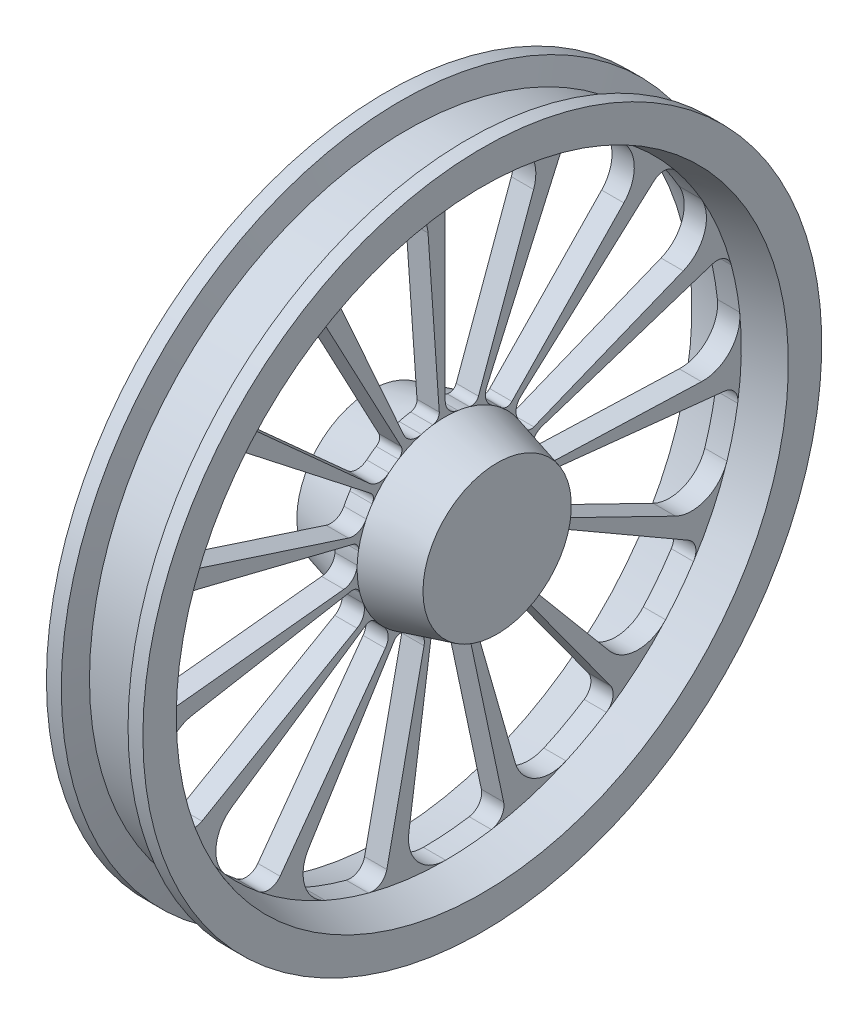
from build123d import *

# Parameters (mm, degrees)
CUT_EXTRUDE1_DEPTH = 655.685038778


with BuildPart() as part:
    # Sketch1 → Revolve1 (revolve)
    with BuildSketch(Plane(origin=(0, 0, 0), x_dir=(1, 0, 0), z_dir=(0, 1, 0)), mode=Mode.PRIVATE) as revolve1_sk:
        Polygon((85, 0), (85, 100), (15, 118.75644347), (15, 399.102540378), (65, 412.5), (65, 457.5), (45, 457.5), (36.961524227, 427.5), (-36.961524227, 427.5), (-45, 457.5), (-65, 457.5), (-65, 412.5), (-15, 399.102540378), (-15, 118.75644347), (-85, 100), (-85, 0), align=None)
    revolve(revolve1_sk.sketch.rotate(Axis((-85, 0, 0), (1, 0, 0)), 180), axis=Axis((-85, 0, 0), (1, 0, 0)))

    # Sketch2 → Cut-Extrude1 (cut, through all)
    with BuildSketch(Plane(origin=(15, 0, 0), x_dir=(0, 0, -1), z_dir=(1, 0, 0))):
        with BuildLine():
            Line((0, 378.574611036), (0, 137.307503817))
            ThreePointArc((0, 137.307503817), (4.872955011, 124.224212568), (17.11725099, 117.516350285))
            ThreePointArc((17.11725099, 117.516350285), (24.945394865, 116.106934077), (32.661634023, 114.176663678))
            ThreePointArc((32.661634023, 114.176663678), (39.954655603, 114.882387256), (44.808864389, 120.370817503))
            Line((44.808864389, 120.370817503), (119.095852039, 324.472638633))
            ThreePointArc((119.095852039, 324.472638633), (115.825470883, 365.844293858), (82.439306972, 390.495324431))
            ThreePointArc((82.439306972, 390.495324431), (51.903571038, 395.713099417), (21.055123502, 398.546759504))
            ThreePointArc((21.055123502, 398.546759504), (6.235961168, 393.084994733), (0, 378.574611036))
        make_face()
        with BuildLine():
            Line((153.980166447, 345.845116291), (55.847993172, 125.436646412))
            ThreePointArc((55.847993172, 125.436646412), (54.978205124, 111.502455758), (63.435592711, 100.394314795))
            ThreePointArc((63.435592711, 100.394314795), (70.013696772, 95.922756059), (76.277720303, 91.020889092))
            ThreePointArc((76.277720303, 91.020889092), (83.227270678, 88.699260545), (89.89415676, 91.738806481))
            Line((89.89415676, 91.738806481), (240.774386462, 247.97985809))
            ThreePointArc((240.774386462, 247.97985809), (254.614112777, 287.104929649), (234.140811811, 323.204142889))
            ThreePointArc((234.140811811, 323.204142889), (208.367289235, 340.390820254), (181.338383505, 355.52669155))
            ThreePointArc((181.338383505, 355.52669155), (165.5789052, 356.564617494), (153.980166447, 345.845116291))
        make_face()
        with BuildLine():
            Line((281.335763249, 253.315859035), (102.039360961, 91.876653287))
            ThreePointArc((102.039360961, 91.876653287), (95.57722411, 79.500911379), (98.785344157, 65.913190223))
            ThreePointArc((98.785344157, 65.913190223), (102.975994453, 59.152662088), (106.704695781, 52.126775883))
            ThreePointArc((106.704695781, 52.126775883), (112.109134558, 47.17922588), (119.435932765, 47.244322398))
            Line((119.435932765, 47.244322398), (320.820842099, 128.609107256))
            ThreePointArc((320.820842099, 128.609107256), (349.377661475, 158.722514837), (345.357243186, 200.028028825))
            ThreePointArc((345.357243186, 200.028028825), (328.802410166, 226.211875916), (310.266589592, 251.032828769))
            ThreePointArc((310.266589592, 251.032828769), (296.291752286, 258.390978603), (281.335763249, 253.315859035))
        make_face()
        with BuildLine():
            Line((360.04585073, 116.985988449), (130.587196242, 42.430352135))
            ThreePointArc((130.587196242, 42.430352135), (119.650072756, 33.75293718), (117.054212162, 20.035076259))
            ThreePointArc((117.054212162, 20.035076259), (118.132807185, 12.154535457), (118.681459977, 4.219469567))
            ThreePointArc((118.681459977, 4.219469567), (121.606310593, -2.498525551), (128.326150953, -5.419134229))
            Line((128.326150953, -5.419134229), (345.394459571, -12.999326599))
            ThreePointArc((345.394459571, -12.999326599), (383.730638507, 2.895535261), (396.858269742, 42.265251379))
            ThreePointArc((396.858269742, 42.265251379), (392.384607303, 72.918843162), (385.546883655, 103.133109332))
            ThreePointArc((385.546883655, 103.133109332), (375.773063676, 115.539192102), (360.04585073, 116.985988449))
        make_face()
        with BuildLine():
            Line((376.500739706, -39.571822324), (136.555318945, -14.352542369))
            ThreePointArc((136.555318945, -14.352542369), (123.034336835, -17.831226494), (115.08334348, -29.307284402))
            ThreePointArc((115.08334348, -29.307284402), (112.863384353, -36.945220775), (110.137121556, -44.41742137))
            ThreePointArc((110.137121556, -44.41742137), (110.076650767, -51.744259215), (115.027611835, -57.145573317))
            Line((115.027611835, -57.145573317), (310.246237173, -152.360058789))
            ThreePointArc((310.246237173, -152.360058789), (351.733102059, -153.432108666), (379.738896115, -122.805571999))
            ThreePointArc((379.738896115, -122.805571999), (388.119941135, -92.982520022), (394.162618951, -62.599261644))
            ThreePointArc((394.162618951, -62.599261644), (390.279798565, -47.290370353), (376.500739706, -39.571822324))
        make_face()
        with BuildLine():
            Line((327.855230385, -189.287305518), (118.911786436, -68.653751909))
            ThreePointArc((118.911786436, -68.653751909), (105.144846344, -66.332209115), (93.213519211, -73.582149343))
            ThreePointArc((93.213519211, -73.582149343), (88.078857034, -79.656812699), (82.549074253, -85.374136632))
            ThreePointArc((82.549074253, -85.374136632), (79.51373801, -92.042940379), (81.839753638, -98.991023627))
            Line((81.839753638, -98.991023627), (221.453621869, -265.376352668))
            ThreePointArc((221.453621869, -265.376352668), (258.917716869, -283.229947119), (296.95921753, -266.642196324))
            ThreePointArc((296.95921753, -266.642196324), (316.745811186, -242.806360774), (334.624056575, -217.507651584))
            ThreePointArc((334.624056575, -217.507651584), (337.303610701, -201.942998155), (327.855230385, -189.287305518))
        make_face()
        with BuildLine():
            Line((222.52057326, -306.273293967), (80.707325773, -111.084104043))
            ThreePointArc((80.707325773, -111.084104043), (69.074856708, -103.363750171), (55.226230652, -105.133992189))
            ThreePointArc((55.226230652, -105.133992189), (48.064695162, -108.595018047), (40.687542077, -111.568888071))
            ThreePointArc((40.687542077, -111.568888071), (35.20217759, -116.426560968), (34.501058546, -123.720026647))
            Line((34.501058546, -123.720026647), (94.369663501, -332.506664302))
            ThreePointArc((94.369663501, -332.506664302), (121.33310624, -364.054754651), (162.832592445, -364.373962536))
            ThreePointArc((162.832592445, -364.373962536), (190.603452938, -350.646775922), (217.225954853, -334.806992571))
            ThreePointArc((217.225954853, -334.806992571), (226.004564241, -321.677846981), (222.52057326, -306.273293967))
        make_face()
        with BuildLine():
            Line((78.710087481, -370.301847484), (28.547835281, -134.307005421))
            ThreePointArc((28.547835281, -134.307005421), (21.061196823, -122.522759792), (7.689825099, -118.507212673))
            ThreePointArc((7.689825099, -118.507212673), (-0.260289157, -118.75615822), (-8.209235759, -118.472365191))
            ThreePointArc((-8.209235759, -118.472365191), (-15.196159136, -120.678971463), (-18.803183001, -127.056713098))
            Line((-18.803183001, -127.056713098), (-49.031667007, -342.143552949))
            ThreePointArc((-49.031667007, -342.143552949), (-37.231100736, -381.93118777), (0.550732838, -399.102160392))
            ThreePointArc((0.550732838, -399.102160392), (31.504026098, -397.857177987), (62.267512102, -394.215162916))
            ThreePointArc((62.267512102, -394.215162916), (75.627275436, -385.791673713), (78.710087481, -370.301847484))
        make_face()
        with BuildLine():
            Line((-78.710087481, -370.301847484), (-28.547835281, -134.307005421))
            ThreePointArc((-28.547835281, -134.307005421), (-30.594135328, -120.496471161), (-41.176221074, -111.389459482))
            ThreePointArc((-41.176221074, -111.389459482), (-48.540267116, -108.383279771), (-55.686562153, -104.890894082))
            ThreePointArc((-55.686562153, -104.890894082), (-62.966941895, -104.064891458), (-68.856183386, -108.424139581))
            Line((-68.856183386, -108.424139581), (-183.954976852, -292.620713016))
            ThreePointArc((-183.954976852, -292.620713016), (-189.35771216, -333.768248788), (-161.82635348, -364.821968988))
            ThreePointArc((-161.82635348, -364.821968988), (-133.042733058, -376.27445956), (-103.457549175, -385.459950261))
            ThreePointArc((-103.457549175, -385.459950261), (-87.826656344, -383.198615252), (-78.710087481, -370.301847484))
        make_face()
        with BuildLine():
            Line((-222.52057326, -306.273293967), (-80.707325773, -111.084104043))
            ThreePointArc((-80.707325773, -111.084104043), (-76.959463542, -97.63524799), (-82.922524549, -85.011456805))
            ThreePointArc((-82.922524549, -85.011456805), (-88.427191916, -79.269947619), (-93.535176055, -73.172834482))
            ThreePointArc((-93.535176055, -73.172834482), (-99.850168364, -69.457046321), (-107.003324124, -71.044047327))
            Line((-107.003324124, -71.044047327), (-287.07080002, -192.501093426))
            ThreePointArc((-287.07080002, -192.501093426), (-308.742654891, -227.893747402), (-296.222193135, -267.460744841))
            ThreePointArc((-296.222193135, -267.460744841), (-274.585195014, -289.630468728), (-251.293860317, -310.055210412))
            ThreePointArc((-251.293860317, -310.055210412), (-236.094561362, -314.347034965), (-222.52057326, -306.273293967))
        make_face()
        with BuildLine():
            Line((-327.855230385, -189.287305518), (-118.911786436, -68.653751909))
            ThreePointArc((-118.911786436, -68.653751909), (-110.017801355, -57.892003453), (-110.330770202, -43.934200942))
            ThreePointArc((-110.330770202, -43.934200942), (-113.024251898, -36.450121378), (-115.210708276, -28.802527046))
            ThreePointArc((-115.210708276, -28.802527046), (-119.468393612, -22.839446877), (-126.648618027, -21.379793876))
            Line((-126.648618027, -21.379793876), (-340.549473909, -59.096285965))
            ThreePointArc((-340.549473909, -59.096285965), (-374.743187752, -82.614346739), (-379.398524502, -123.853128107))
            ThreePointArc((-379.398524502, -123.853128107), (-368.649382224, -152.906738643), (-355.679180077, -181.039107919))
            ThreePointArc((-355.679180077, -181.039107919), (-343.539571869, -191.141996578), (-327.855230385, -189.287305518))
        make_face()
        with BuildLine():
            Line((-376.500739706, -39.571822324), (-136.555318945, -14.352542369))
            ThreePointArc((-136.555318945, -14.352542369), (-124.053061833, -8.138705587), (-118.661823363, 4.739677394))
            ThreePointArc((-118.661823363, 4.739677394), (-118.078391934, 12.672261988), (-116.96526238, 20.547998979))
            ThreePointArc((-116.96526238, 20.547998979), (-118.429448268, 27.727300422), (-124.395215306, 31.981220165))
            Line((-124.395215306, 31.981220165), (-335.144049964, 84.526806212))
            ThreePointArc((-335.144049964, 84.526806212), (-375.947219016, 76.949825002), (-396.973404256, 41.169819647))
            ThreePointArc((-396.973404256, 41.169819647), (-398.970742173, 10.255955668), (-398.564338358, -20.719698979))
            ThreePointArc((-398.564338358, -20.719698979), (-391.58346944, -34.886770513), (-376.500739706, -39.571822324))
        make_face()
        with BuildLine():
            Line((-360.04585073, 116.985988449), (-130.587196242, 42.430352135))
            ThreePointArc((-130.587196242, 42.430352135), (-116.638420933, 43.021848413), (-106.475169256, 52.59402245))
            ThreePointArc((-106.475169256, 52.59402245), (-102.715705296, 59.603496132), (-98.495460023, 66.345589308))
            ThreePointArc((-98.495460023, 66.345589308), (-96.912975421, 73.499745583), (-100.632749764, 79.8123907))
            Line((-100.632749764, 79.8123907), (-271.789175092, 213.534445693))
            ThreePointArc((-271.789175092, 213.534445693), (-312.146560739, 223.208672933), (-345.907976024, 199.074131568))
            ThreePointArc((-345.907976024, 199.074131568), (-360.306436264, 171.645302071), (-372.534101693, 143.182334148))
            ThreePointArc((-372.534101693, 143.182334148), (-371.919027722, 127.40069511), (-360.04585073, 116.985988449))
        make_face()
        with BuildLine():
            Line((-281.335763249, 253.315859035), (-102.039360961, 91.876653287))
            ThreePointArc((-102.039360961, 91.876653287), (-89.055937428, 86.743533982), (-75.877991089, 91.354383223))
            ThreePointArc((-75.877991089, 91.354383223), (-69.59254007, 96.228744315), (-62.994897824, 100.671424515))
            ThreePointArc((-62.994897824, 100.671424515), (-58.639368697, 106.563417009), (-59.469967567, 113.84327381))
            Line((-59.469967567, 113.84327381), (-161.439482719, 305.620039614))
            ThreePointArc((-161.439482719, 305.620039614), (-194.372926348, 330.872713527), (-235.031916262, 322.556717609))
            ThreePointArc((-235.031916262, 322.556717609), (-259.341874245, 303.355616397), (-282.08933448, 282.326840929))
            ThreePointArc((-282.08933448, 282.326840929), (-287.946407331, 267.65942315), (-281.335763249, 253.315859035))
        make_face()
        with BuildLine():
            Line((-153.980166447, 345.845116291), (-55.847993172, 125.436646412))
            ThreePointArc((-55.847993172, 125.436646412), (-46.074873293, 115.466474484), (-32.160818932, 114.318741208))
            ThreePointArc((-32.160818932, 114.318741208), (-24.436192437, 116.215168394), (-16.601945501, 117.590255852))
            ThreePointArc((-16.601945501, 117.590255852), (-10.226482404, 121.201305536), (-8.024287711, 128.189620644))
            Line((-8.024287711, 128.189620644), (-23.175437153, 344.861152215))
            ThreePointArc((-23.175437153, 344.861152215), (-42.990447168, 381.325856068), (-83.51670298, 390.26631684))
            ThreePointArc((-83.51670298, 390.26631684), (-113.534746121, 382.612988749), (-142.868758634, 372.654472055))
            ThreePointArc((-142.868758634, 372.654472055), (-154.185237202, 361.637405317), (-153.980166447, 345.845116291))
        make_face()
    extrude(amount=-CUT_EXTRUDE1_DEPTH, mode=Mode.SUBTRACT)


solid = part.part
